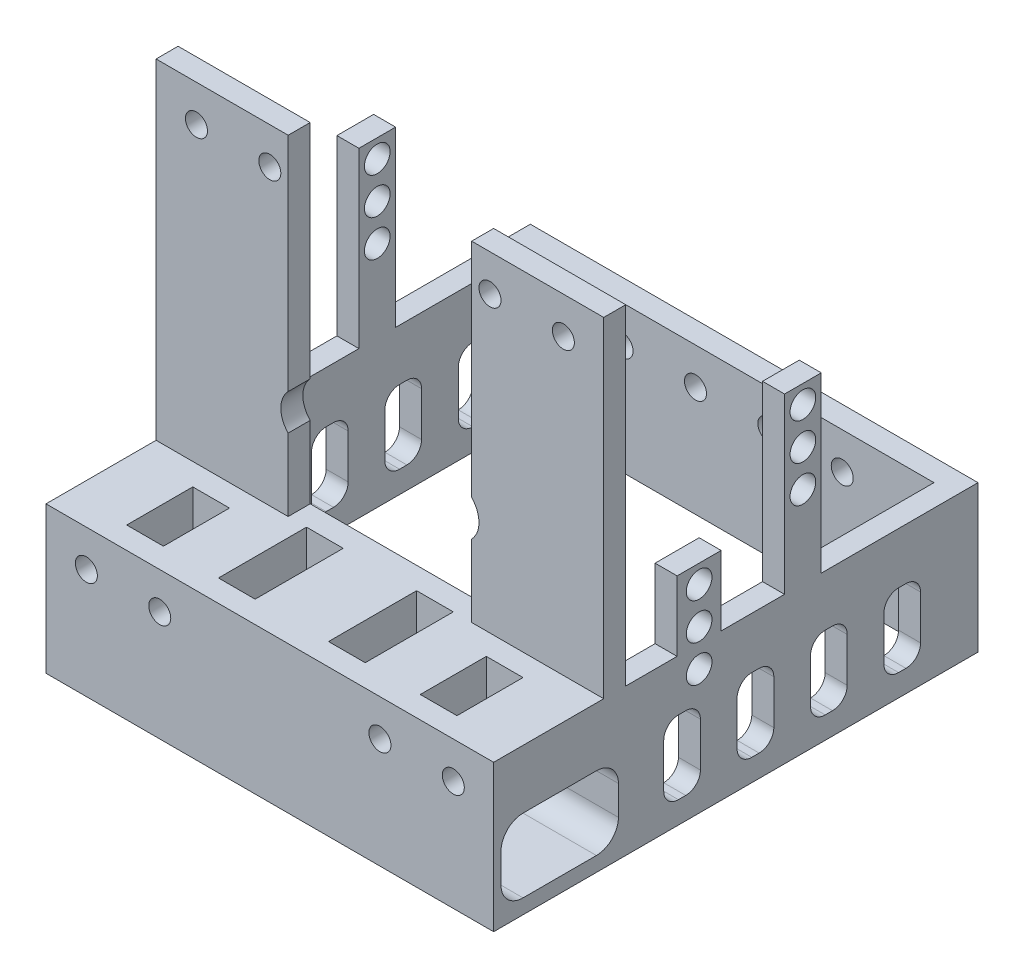
from build123d import *
from build123d.topology import SkipClean

# Parameters (mm, degrees)
SKETCH1_W           = 55
SKETCH1_H           = 10
SKETCH1_R           = 1.5
BOSS_EXTRUDE1_DEPTH = 15
BOSS_EXTRUDE2_START = 3
SKETCH2_W           = 25
SKETCH2_H           = 10
SKETCH2_R           = 1.5
SKETCH2_W_2         = 15
BOSS_EXTRUDE2_DEPTH = 3
SKETCH3_W           = 55
SKETCH3_H           = 18
BOSS_EXTRUDE3_DEPTH = 10
BOSS_EXTRUDE5_DEPTH = 3
BOSS_EXTRUDE6_DEPTH = 3
CUT_EXTRUDE2_DEPTH  = 84.492514635
SKETCH10_W          = 3
SKETCH10_H          = 20
BOSS_EXTRUDE7_DEPTH = 45
SKETCH11_R          = 1.75
CUT_EXTRUDE3_DEPTH  = 96.131487952
SKETCH12_W          = 5
SKETCH12_H          = 23.64
SKETCH12_R          = 1.75
SKETCH12_W_2        = 6
SKETCH12_H_2        = 9.5
BOSS_EXTRUDE8_DEPTH = 3
BOSS_EXTRUDE9_START = 3
SKETCH13_W          = 61
SKETCH13_H          = 20
SKETCH13_R          = 1.5
BOSS_EXTRUDE9_DEPTH = 3
SKETCH14_W          = 5
SKETCH14_H          = 12
SKETCH14_H_2        = 9
CUT_EXTRUDE4_DEPTH  = 10
CUT_EXTRUDE5_DEPTH  = 97.679884154


with BuildPart() as part:
    # Sketch1 → Boss-Extrude1 (new body)
    with BuildSketch(Plane.XY):
        with Locations((-27.5, 5)):
            Rectangle(SKETCH1_W, SKETCH1_H)
        with Locations((-2.5, 5)):
            Circle(SKETCH1_R, mode=Mode.SUBTRACT)
        with Locations((-12.5, 5)):
            Circle(SKETCH1_R, mode=Mode.SUBTRACT)
        with Locations((-42.5, 5)):
            Circle(SKETCH1_R, mode=Mode.SUBTRACT)
        with Locations((-52.5, 5)):
            Circle(SKETCH1_R, mode=Mode.SUBTRACT)
    extrude(amount=BOSS_EXTRUDE1_DEPTH)

    # Sketch2 → Boss-Extrude2 (add)
    # profile 1 of 5: a face of its own
    with SkipClean():  # the faces are left unmerged after this step: merging them gives an invalid solid
        with BuildSketch(Plane(origin=(0, 0, 0), x_dir=(-1, 0, 0), z_dir=(0, 0, -1)).offset(BOSS_EXTRUDE2_START)):
            with Locations((27.5, 5)):
                Rectangle(SKETCH2_W, SKETCH2_H)
        # profile 2 of 5: a face of its own
        with BuildSketch(Plane(origin=(0, 0, 0), x_dir=(-1, 0, 0), z_dir=(0, 0, -1)).offset(BOSS_EXTRUDE2_START)):
            with BuildLine():
                Line((0, 55), (0, 10))
                Line((0, 10), (15, 10))
                Line((15, 10), (15, 19.850540474))
                ThreePointArc((15, 19.850540474), (14, 22.300030217), (15, 24.74951996))
                Line((15, 24.74951996), (15, 55))
                Line((15, 55), (0, 55))
            make_face()
            with Locations((2.5, 50)):
                Circle(SKETCH2_R, mode=Mode.SUBTRACT)
            with Locations((12.5, 50)):
                Circle(SKETCH2_R, mode=Mode.SUBTRACT)
        # profile 3 of 5: a face of its own
        with BuildSketch(Plane(origin=(0, 0, 0), x_dir=(-1, 0, 0), z_dir=(0, 0, -1)).offset(BOSS_EXTRUDE2_START)):
            with Locations((7.5, 5)):
                Rectangle(SKETCH2_W_2, SKETCH2_H)
            with Locations((2.5, 5)):
                Circle(SKETCH2_R, mode=Mode.SUBTRACT)
            with Locations((12.5, 5)):
                Circle(SKETCH2_R, mode=Mode.SUBTRACT)
        # profile 4 of 5: a face of its own
        with BuildSketch(Plane(origin=(0, 0, 0), x_dir=(-1, 0, 0), z_dir=(0, 0, -1)).offset(BOSS_EXTRUDE2_START)):
            with Locations((47.5, 5)):
                Rectangle(SKETCH2_W_2, SKETCH2_H)
            with Locations((42.5, 5)):
                Circle(SKETCH2_R, mode=Mode.SUBTRACT)
            with Locations((52.5, 5)):
                Circle(SKETCH2_R, mode=Mode.SUBTRACT)
        # profile 5 of 5: a face of its own
        with BuildSketch(Plane(origin=(0, 0, 0), x_dir=(-1, 0, 0), z_dir=(0, 0, -1)).offset(BOSS_EXTRUDE2_START)):
            with BuildLine():
                Line((40, 19.850540474), (40, 10))
                Line((40, 10), (55, 10))
                Line((55, 10), (55, 55))
                Line((55, 55), (40, 55))
                Line((40, 55), (40, 24.74951996))
                ThreePointArc((40, 24.74951996), (40.740370349, 23.622905872), (41, 22.300030217))
                ThreePointArc((41, 22.300030217), (40.740370349, 20.977154561), (40, 19.850540474))
            make_face()
            with Locations((42.5, 50)):
                Circle(SKETCH2_R, mode=Mode.SUBTRACT)
            with Locations((52.5, 50)):
                Circle(SKETCH2_R, mode=Mode.SUBTRACT)
        extrude(amount=-BOSS_EXTRUDE2_DEPTH)

    # Sketch3 → Boss-Extrude3 (add)
    with SkipClean():  # the faces are left unmerged after this step: merging them gives an invalid solid
        with BuildSketch(Plane.XZ):
            with Locations((-27.5, 6)):
                Rectangle(SKETCH3_W, SKETCH3_H)
        extrude(amount=BOSS_EXTRUDE3_DEPTH)

    # Sketch6 → Boss-Extrude5 (add)
    with SkipClean():  # the faces are left unmerged after this step: merging them gives an invalid solid
        with BuildSketch(Plane(origin=(0, 0, 0), x_dir=(0, 0, -1), z_dir=(1, 0, 0))):
            Polygon((-15, 10), (-15, -10), (3, -10), (3, 55), (0, 55), (0, 10), align=None)
        extrude(amount=BOSS_EXTRUDE5_DEPTH)

    # Sketch8 → Boss-Extrude6 (add)
    with SkipClean():  # the faces are left unmerged after this step: merging them gives an invalid solid
        with BuildSketch(Plane.ZY.offset(55)):
            Polygon((15, 10), (0, 10), (0, 55), (-3, 55), (-3, -10), (15, -10), align=None)
        extrude(amount=BOSS_EXTRUDE6_DEPTH)

    # Sketch9 → Cut-Extrude2 (cut, through all)
    with SkipClean():  # the faces are left unmerged after this step: merging them gives an invalid solid
        with BuildSketch(Plane.ZY.offset(58)):
            with BuildLine():
                Line((1, -8), (11, -8))
                ThreePointArc((11, -8), (13.121320344, -7.121320344), (14, -5))
                Line((14, -5), (14, -1))
                ThreePointArc((14, -1), (13.121320344, 1.121320344), (11, 2))
                Line((11, 2), (1, 2))
                ThreePointArc((1, 2), (-1.121320344, 1.121320344), (-2, -1))
                Line((-2, -1), (-2, -5))
                ThreePointArc((-2, -5), (-1.121320344, -7.121320344), (1, -8))
            make_face()
        extrude(amount=-CUT_EXTRUDE2_DEPTH, mode=Mode.SUBTRACT)

    # Sketch10 → Boss-Extrude7 (add)
    with SkipClean():  # the faces are left unmerged after this step: merging them gives an invalid solid
        with BuildSketch(Plane(origin=(0, 0, -3), x_dir=(-1, 0, 0), z_dir=(0, 0, -1))):
            with Locations((56.5, 0)):
                Rectangle(SKETCH10_W, SKETCH10_H)
            with Locations((-1.5, 0)):
                Rectangle(SKETCH10_W, SKETCH10_H)
        extrude(amount=BOSS_EXTRUDE7_DEPTH)

    # Sketch11 → Cut-Extrude3 (cut, through all)
    with SkipClean():  # the faces are left unmerged after this step: merging them gives an invalid solid
        with BuildSketch(Plane.ZY.offset(58)):
            with Locations((-13, 7)):
                Circle(SKETCH11_R)
        extrude(amount=-CUT_EXTRUDE3_DEPTH, mode=Mode.SUBTRACT)

    # Sketch12 → Boss-Extrude8 (add)
    # profile 1 of 2: a face of its own
    with SkipClean():  # the faces are left unmerged after this step: merging them gives an invalid solid
        with BuildSketch(Plane.ZY.offset(58)):
            with Locations((-27.14, 21.82)):
                Rectangle(SKETCH12_W, SKETCH12_H)
            with Locations((-27.14, 31.14)):
                Circle(SKETCH12_R, mode=Mode.SUBTRACT)
            with Locations((-27.14, 26.14)):
                Circle(SKETCH12_R, mode=Mode.SUBTRACT)
            with Locations((-27.14, 21.14)):
                Circle(SKETCH12_R, mode=Mode.SUBTRACT)
        # profile 2 of 2: a face of its own
        with BuildSketch(Plane.ZY.offset(58)):
            with Locations((-13, 14.75)):
                Rectangle(SKETCH12_W_2, SKETCH12_H_2)
            with Locations((-13, 17)):
                Circle(SKETCH12_R, mode=Mode.SUBTRACT)
            with Locations((-13, 12)):
                Circle(SKETCH12_R, mode=Mode.SUBTRACT)
        boss_extrude8 = extrude(amount=-BOSS_EXTRUDE8_DEPTH)

    # Mirror1: Boss-Extrude8 across plane
    with SkipClean():  # the faces are left unmerged after this step: merging them gives an invalid solid
        add(boss_extrude8.mirror(Plane.ZY.offset(27.5)))

    # Sketch13 → Boss-Extrude9 (add)
    with SkipClean():  # the faces are left unmerged after this step: merging them gives an invalid solid
        with BuildSketch(Plane(origin=(0, 0, -48), x_dir=(-1, 0, 0), z_dir=(0, 0, -1)).offset(BOSS_EXTRUDE9_START)):
            with Locations((27.5, 0)):
                Rectangle(SKETCH13_W, SKETCH13_H)
            with Locations((22.5, 5)):
                Circle(SKETCH13_R, mode=Mode.SUBTRACT)
            with Locations((12.5, 5)):
                Circle(SKETCH13_R, mode=Mode.SUBTRACT)
            with Locations((2.5, 5)):
                Circle(SKETCH13_R, mode=Mode.SUBTRACT)
            with Locations((52.5, 5)):
                Circle(SKETCH13_R, mode=Mode.SUBTRACT)
            with Locations((42.5, 5)):
                Circle(SKETCH13_R, mode=Mode.SUBTRACT)
            with Locations(Location((32.5, 5, 0), (0, 0, 180))):
                Circle(SKETCH13_R, mode=Mode.SUBTRACT)
        extrude(amount=-BOSS_EXTRUDE9_DEPTH)

    # Sketch14 → Cut-Extrude4 (cut)
    with SkipClean():  # the faces are left unmerged after this step: merging them gives an invalid solid
        with BuildSketch(Plane(origin=(0, 10, 0), x_dir=(1, 0, 0), z_dir=(0, 1, 0))):
            with Locations((-35, -6)):
                Rectangle(SKETCH14_W, SKETCH14_H)
            with Locations((-47.5, -7.5)):
                Rectangle(SKETCH14_W, SKETCH14_H_2)
            with Locations((-20, -6)):
                Rectangle(SKETCH14_W, SKETCH14_H)
            with Locations((-7.5, -7.5)):
                Rectangle(SKETCH14_W, SKETCH14_H_2)
        extrude(amount=-CUT_EXTRUDE4_DEPTH, mode=Mode.SUBTRACT)

    # Sketch15 → Cut-Extrude5 (cut, through all)
    with SkipClean():  # the faces are left unmerged after this step: merging them gives an invalid solid
        with BuildSketch(Plane.ZY.offset(58)):
            with BuildLine():
                Line((-10.176090021, -7), (-11.176090021, -7))
                ThreePointArc((-11.176090021, -7), (-12.590303583, -6.414213562), (-13.176090021, -5))
                Line((-13.176090021, -5), (-13.176090021, 1))
                ThreePointArc((-13.176090021, 1), (-12.590303583, 2.414213562), (-11.176090021, 3))
                Line((-11.176090021, 3), (-10.176090021, 3))
                ThreePointArc((-10.176090021, 3), (-8.761876459, 2.414213562), (-8.176090021, 1))
                Line((-8.176090021, 1), (-8.176090021, -5))
                ThreePointArc((-8.176090021, -5), (-8.761876459, -6.414213562), (-10.176090021, -7))
            make_face()
            with BuildLine():
                Line((-18.176090021, -5), (-18.176090021, 1))
                ThreePointArc((-18.176090021, 1), (-18.761876459, 2.414213562), (-20.176090021, 3))
                Line((-20.176090021, 3), (-21.176090021, 3))
                ThreePointArc((-21.176090021, 3), (-22.590303583, 2.414213562), (-23.176090021, 1))
                Line((-23.176090021, 1), (-23.176090021, -5))
                ThreePointArc((-23.176090021, -5), (-22.590303583, -6.414213562), (-21.176090021, -7))
                Line((-21.176090021, -7), (-20.176090021, -7))
                ThreePointArc((-20.176090021, -7), (-18.761876459, -6.414213562), (-18.176090021, -5))
            make_face()
            with BuildLine():
                Line((-28.176090021, -5), (-28.176090021, 1))
                ThreePointArc((-28.176090021, 1), (-28.761876459, 2.414213562), (-30.176090021, 3))
                Line((-30.176090021, 3), (-31.176090021, 3))
                ThreePointArc((-31.176090021, 3), (-32.590303583, 2.414213562), (-33.176090021, 1))
                Line((-33.176090021, 1), (-33.176090021, -5))
                ThreePointArc((-33.176090021, -5), (-32.590303583, -6.414213562), (-31.176090021, -7))
                Line((-31.176090021, -7), (-30.176090021, -7))
                ThreePointArc((-30.176090021, -7), (-28.761876459, -6.414213562), (-28.176090021, -5))
            make_face()
            with BuildLine():
                Line((-38.176090021, -5), (-38.176090021, 1))
                ThreePointArc((-38.176090021, 1), (-38.761876459, 2.414213562), (-40.176090021, 3))
                Line((-40.176090021, 3), (-41.176090021, 3))
                ThreePointArc((-41.176090021, 3), (-42.590303583, 2.414213562), (-43.176090021, 1))
                Line((-43.176090021, 1), (-43.176090021, -5))
                ThreePointArc((-43.176090021, -5), (-42.590303583, -6.414213562), (-41.176090021, -7))
                Line((-41.176090021, -7), (-40.176090021, -7))
                ThreePointArc((-40.176090021, -7), (-38.761876459, -6.414213562), (-38.176090021, -5))
            make_face()
        extrude(amount=-CUT_EXTRUDE5_DEPTH, mode=Mode.SUBTRACT)


solid = part.part
